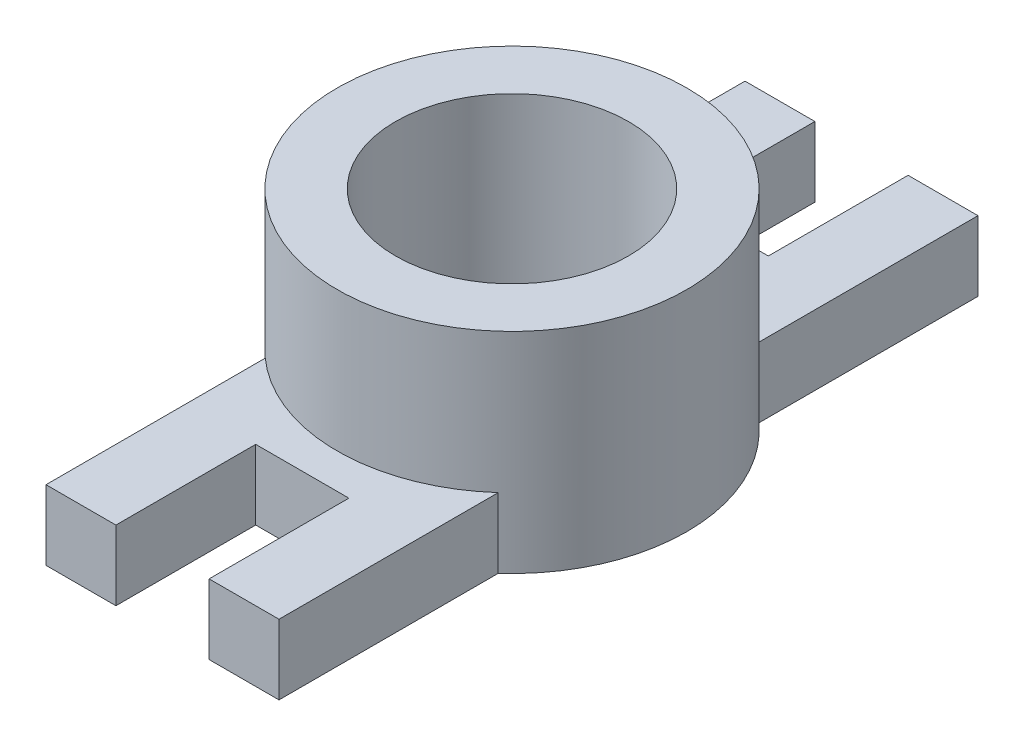
from build123d import *

# Parameters (mm, degrees)
BOSS_EXTRUDE1_DEPTH = 15
SKETCH3_R           = 37.5
SKETCH3_R_2         = 25
BOSS_EXTRUDE2_DEPTH = 45
CUT_EXTRUDE1_START  = -45
SKETCH4_R           = 25
CUT_EXTRUDE1_DEPTH  = 45


with BuildPart() as part:
    # Sketch1 → Boss-Extrude1 (new body)
    with BuildSketch(Plane(origin=(0, 0, 0), x_dir=(1, 0, 0), z_dir=(0, 1, 0))):
        Polygon((-25, 75), (-25, -75), (-10, -75), (-10, -45), (10, -45), (10, -75), (25, -75), (25, 75), (10, 75), (10, 45), (-10, 45), (-10, 75), align=None)
    extrude(amount=BOSS_EXTRUDE1_DEPTH)

    # Sketch3 → Boss-Extrude2 (add)
    with BuildSketch(Plane.XZ):
        with Locations(Location((0, 0, 0), (0, 0, 270))):
            Circle(SKETCH3_R)
        with Locations(Location((0, 0, 0), (0, 0, 270))):
            Circle(SKETCH3_R_2, mode=Mode.SUBTRACT)
    extrude(amount=-BOSS_EXTRUDE2_DEPTH)

    # Sketch4 → Cut-Extrude1 (cut)
    with BuildSketch(Plane(origin=(0, 15, 0), x_dir=(1, 0, 0), z_dir=(0, 1, 0)).offset(CUT_EXTRUDE1_START)):
        with Locations(Location((0, 0, 0), (0, 0, 90))):
            Circle(SKETCH4_R)
    extrude(amount=CUT_EXTRUDE1_DEPTH, mode=Mode.SUBTRACT)


solid = part.part
